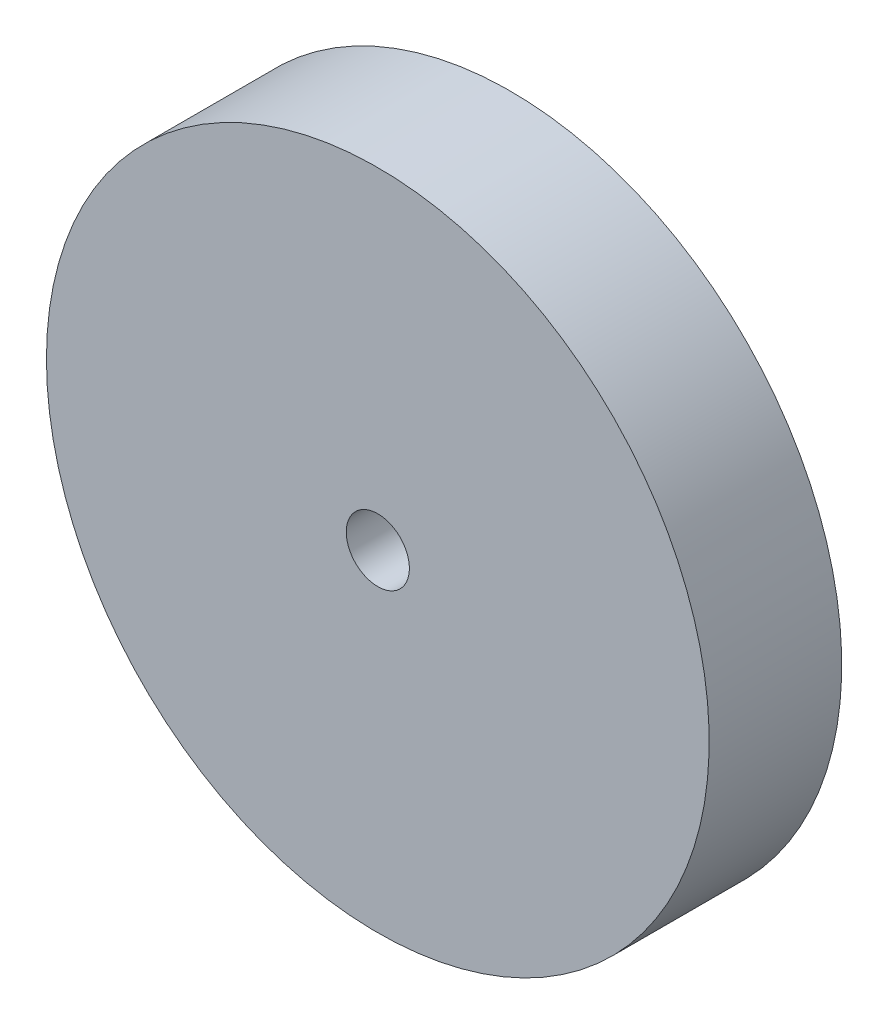
from build123d import *

# Parameters (mm, degrees)
SKETCH1_R           = 52.5
SKETCH1_R_2         = 5
BOSS_EXTRUDE1_DEPTH = 21


with BuildPart() as part:
    # Sketch1 → Boss-Extrude1 (new body)
    with BuildSketch(Plane.XY):
        with Locations(Location((0, 0, 0), (0, 0, 180))):
            Circle(SKETCH1_R)
        with Locations(Location((0, 0, 0), (0, 0, 180))):
            Circle(SKETCH1_R_2, mode=Mode.SUBTRACT)
    extrude(amount=BOSS_EXTRUDE1_DEPTH)


solid = part.part
